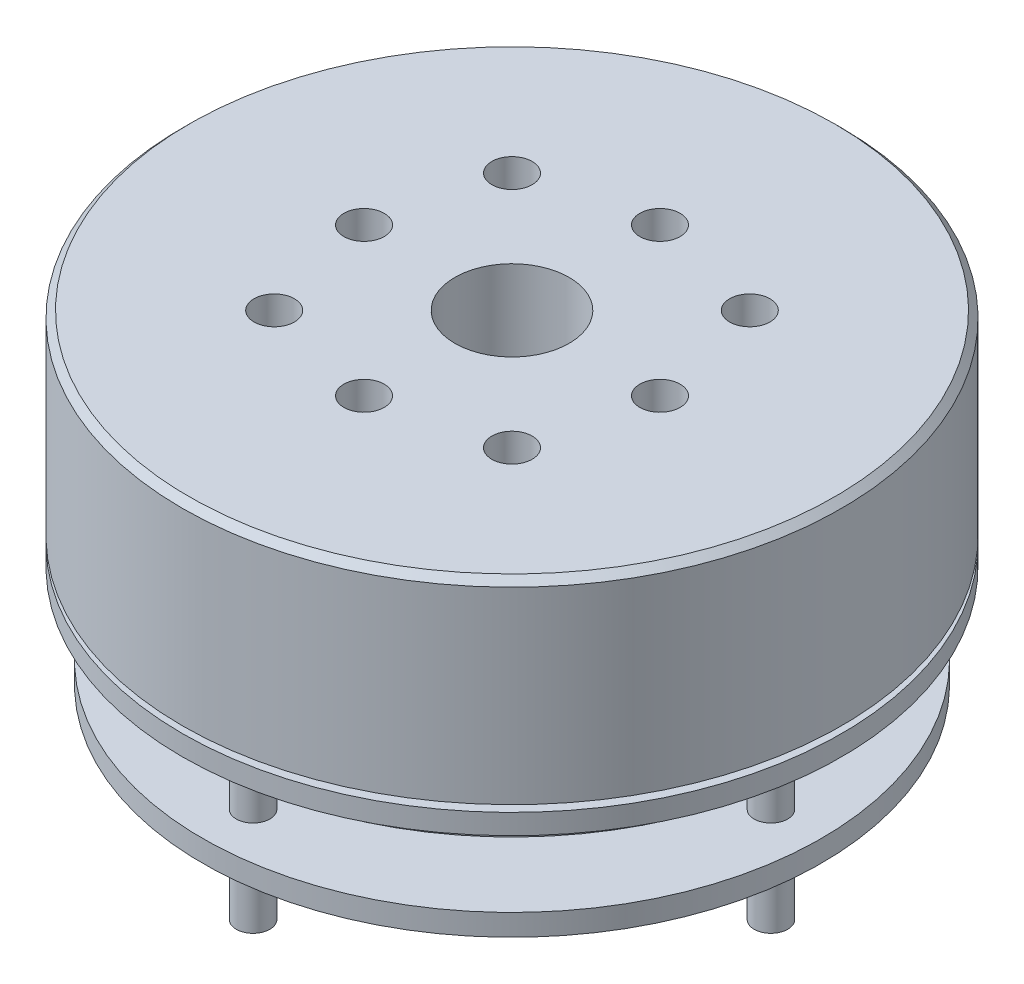
from build123d import *

# Parameters (mm, degrees)
SKETCH_2_R          = 1.5
CUT_EXTRUDE_1_DEPTH = 3
SKETCH_3_R          = 4.25
CUT_EXTRUDE_2_DEPTH = 18
SKETCH_6_R          = 1.25
EXTRUDE_1_DEPTH     = 4.5
SKETCH_7_R          = 23
EXTRUDE_2_DEPTH     = 1.6
SKETCH_10_R         = 1.25
EXTRUDE_3_DEPTH     = 5.5


with BuildPart() as part:
    # 草图1 → 旋转1 (revolve)
    with BuildSketch(Plane.XY, mode=Mode.PRIVATE) as revolve_1_sk:
        Polygon((24, 22.1), (0, 22.1), (0, 4.545296676), (0, 3.1), (8.3, 3.1), (8.3, 4.1), (22.5, 4.1), (22.5, 5.6), (24.5, 5.6), (24.5, 7.1), (23.5, 7.1), (23.5, 7.6), (24.5, 7.6), (24.5, 21.6), align=None)
    revolve(revolve_1_sk.sketch.rotate(Axis((0, 4.545296676, 0), (0, 1, 0)), 90), axis=Axis((0, 4.545296676, 0), (0, 1, 0)))

    # 草图2 → 切除-拉伸1 (cut)
    with BuildSketch(Plane(origin=(0, 22.1, 0), x_dir=(1, 0, 0), z_dir=(0, 1, 0))):
        with Locations(Location((0, 11, 0), (0, 0, 270))):
            Circle(SKETCH_2_R)
        with Locations(Location((11, 0, 0), (0, 0, 270))):
            Circle(SKETCH_2_R)
        with Locations(Location((0, -11, 0), (0, 0, 270))):
            Circle(SKETCH_2_R)
        with Locations(Location((-11, 0, 0), (0, 0, 270))):
            Circle(SKETCH_2_R)
        with Locations(Location((8.838834765, 8.838834765, 0), (0, 0, 270))):
            Circle(SKETCH_2_R)
        with Locations(Location((8.838834765, -8.838834765, 0), (0, 0, 270))):
            Circle(SKETCH_2_R)
        with Locations(Location((-8.838834765, -8.838834765, 0), (0, 0, 270))):
            Circle(SKETCH_2_R)
        with Locations(Location((-8.838834765, 8.838834765, 0), (0, 0, 270))):
            Circle(SKETCH_2_R)
    extrude(amount=-CUT_EXTRUDE_1_DEPTH, mode=Mode.SUBTRACT)

    # 草图3 → 切除-拉伸2 (cut)
    with BuildSketch(Plane(origin=(0, 22.1, 0), x_dir=(1, 0, 0), z_dir=(0, 1, 0))):
        with Locations(Location((0, 0, 0), (0, 0, 270))):
            Circle(SKETCH_3_R)
    extrude(amount=-CUT_EXTRUDE_2_DEPTH, mode=Mode.SUBTRACT)

    # 草图6 → 凸台-拉伸1 (add)
    with BuildSketch(Plane.XZ.offset(-4.1)):
        with Locations(Location((0, 19.25, 0), (0, 0, 270))):
            Circle(SKETCH_6_R)
        with Locations(Location((19.25, 0, 0), (0, 0, 270))):
            Circle(SKETCH_6_R)
        with Locations(Location((0, -19.25, 0), (0, 0, 270))):
            Circle(SKETCH_6_R)
        with Locations(Location((-19.25, 0, 0), (0, 0, 270))):
            Circle(SKETCH_6_R)
    extrude(amount=EXTRUDE_1_DEPTH)

    # 草图7 → 凸台-拉伸2 (add)
    with BuildSketch(Plane.XZ.offset(0.4)):
        with Locations(Location((0, 0, 0), (0, 0, 270))):
            Circle(SKETCH_7_R)
    extrude(amount=EXTRUDE_2_DEPTH)

    # 草图10 → 凸台-拉伸3 (add)
    with BuildSketch(Plane.XZ.offset(2)):
        with Locations(Location((0, 19.25, 0), (0, 0, 270))):
            Circle(SKETCH_10_R)
        with Locations(Location((19.25, 0, 0), (0, 0, 270))):
            Circle(SKETCH_10_R)
        with Locations(Location((0, -19.25, 0), (0, 0, 270))):
            Circle(SKETCH_10_R)
        with Locations(Location((-19.25, 0, 0), (0, 0, 270))):
            Circle(SKETCH_10_R)
    extrude(amount=EXTRUDE_3_DEPTH)


solid = part.part
